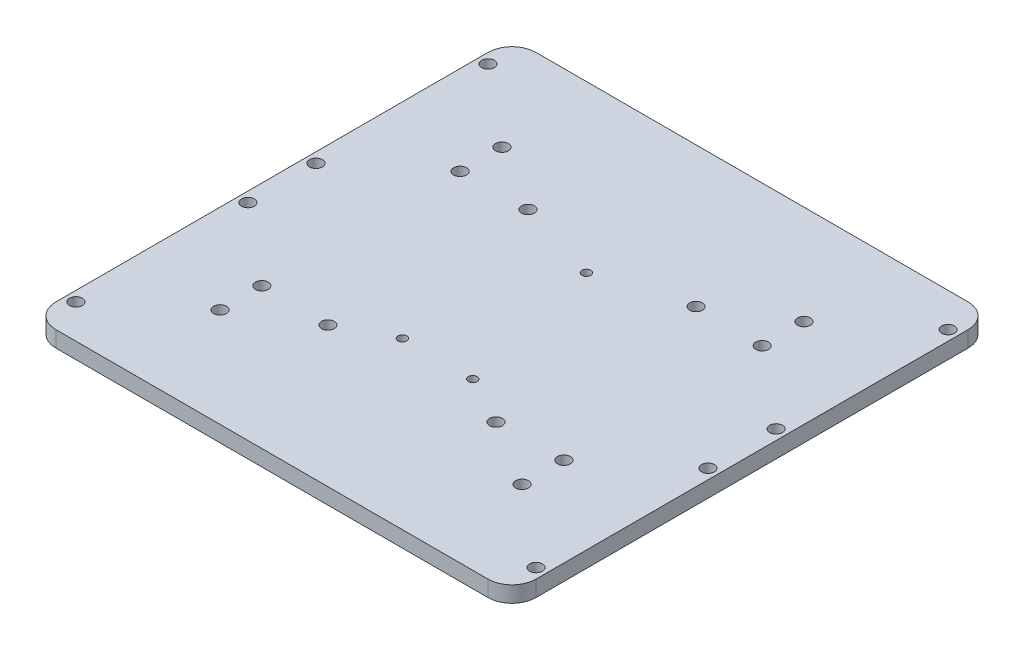
from build123d import *

# Parameters (mm, degrees)
SKETCH_1_R      = 1.6
SKETCH_1_R_2    = 1.1
EXTRUDE_1_DEPTH = 4


with BuildPart() as part:
    # 草图1 → 凸台-拉伸1 (new body)
    with BuildSketch(Plane(origin=(0, 0, 0), x_dir=(1, 0, 0), z_dir=(0, 1, 0))):
        with BuildLine():
            Line((-54, 60), (54, 60))
            ThreePointArc((54, 60), (58.242640687, 58.242640687), (60, 54))
            Line((60, 54), (60, -54))
            ThreePointArc((60, -54), (58.242640687, -58.242640687), (54, -60))
            Line((54, -60), (-54, -60))
            ThreePointArc((-54, -60), (-58.242640687, -58.242640687), (-60, -54))
            Line((-60, -54), (-60, 54))
            ThreePointArc((-60, 54), (-58.242640687, 58.242640687), (-54, 60))
        make_face()
        with Locations(Location((-57.5, 51.5, 0), (0, 0, 270))):
            Circle(SKETCH_1_R, mode=Mode.SUBTRACT)
        with Locations(Location((-57.5, 8.5, 0), (0, 0, 90))):
            Circle(SKETCH_1_R, mode=Mode.SUBTRACT)
        with Locations(Location((-37.75, 35.23, 0), (0, 0, 270))):
            Circle(SKETCH_1_R, mode=Mode.SUBTRACT)
        with Locations(Location((-37.75, 24.77, 0), (0, 0, 90))):
            Circle(SKETCH_1_R, mode=Mode.SUBTRACT)
        with Locations(Location((-57.5, -8.5, 0), (0, 0, 270))):
            Circle(SKETCH_1_R, mode=Mode.SUBTRACT)
        with Locations(Location((-37.75, -24.77, 0), (0, 0, 270))):
            Circle(SKETCH_1_R, mode=Mode.SUBTRACT)
        with Locations(Location((-37.75, -35.23, 0), (0, 0, 90))):
            Circle(SKETCH_1_R, mode=Mode.SUBTRACT)
        with Locations(Location((-57.5, -51.5, 0), (0, 0, 90))):
            Circle(SKETCH_1_R, mode=Mode.SUBTRACT)
        with Locations(Location((57.5, -51.5, 0), (0, 0, 270))):
            Circle(SKETCH_1_R, mode=Mode.SUBTRACT)
        with Locations(Location((37.75, -35.23, 0), (0, 0, 270))):
            Circle(SKETCH_1_R, mode=Mode.SUBTRACT)
        with Locations(Location((37.75, -24.77, 0), (0, 0, 90))):
            Circle(SKETCH_1_R, mode=Mode.SUBTRACT)
        with Locations(Location((57.5, -8.5, 0), (0, 0, 90))):
            Circle(SKETCH_1_R, mode=Mode.SUBTRACT)
        with Locations(Location((57.5, 8.5, 0), (0, 0, 270))):
            Circle(SKETCH_1_R, mode=Mode.SUBTRACT)
        with Locations(Location((37.75, 24.77, 0), (0, 0, 270))):
            Circle(SKETCH_1_R, mode=Mode.SUBTRACT)
        with Locations(Location((37.75, 35.23, 0), (0, 0, 90))):
            Circle(SKETCH_1_R, mode=Mode.SUBTRACT)
        with Locations(Location((57.5, 51.5, 0), (0, 0, 90))):
            Circle(SKETCH_1_R, mode=Mode.SUBTRACT)
        with Locations(Location((0, 18.6, 0), (0, 0, 270))):
            Circle(SKETCH_1_R_2, mode=Mode.SUBTRACT)
        with Locations(Location((8.8, -18.6, 0), (0, 0, 270))):
            Circle(SKETCH_1_R_2, mode=Mode.SUBTRACT)
        with Locations(Location((-8.8, -18.6, 0), (0, 0, 270))):
            Circle(SKETCH_1_R_2, mode=Mode.SUBTRACT)
        with Locations(Location((-21, 25, 0), (0, 0, 270))):
            Circle(SKETCH_1_R, mode=Mode.SUBTRACT)
        with Locations(Location((21, 25, 0), (0, 0, 90))):
            Circle(SKETCH_1_R, mode=Mode.SUBTRACT)
        with Locations(Location((21, -25, 0), (0, 0, 270))):
            Circle(SKETCH_1_R, mode=Mode.SUBTRACT)
        with Locations(Location((-21, -25, 0), (0, 0, 90))):
            Circle(SKETCH_1_R, mode=Mode.SUBTRACT)
    extrude(amount=EXTRUDE_1_DEPTH)


solid = part.part
